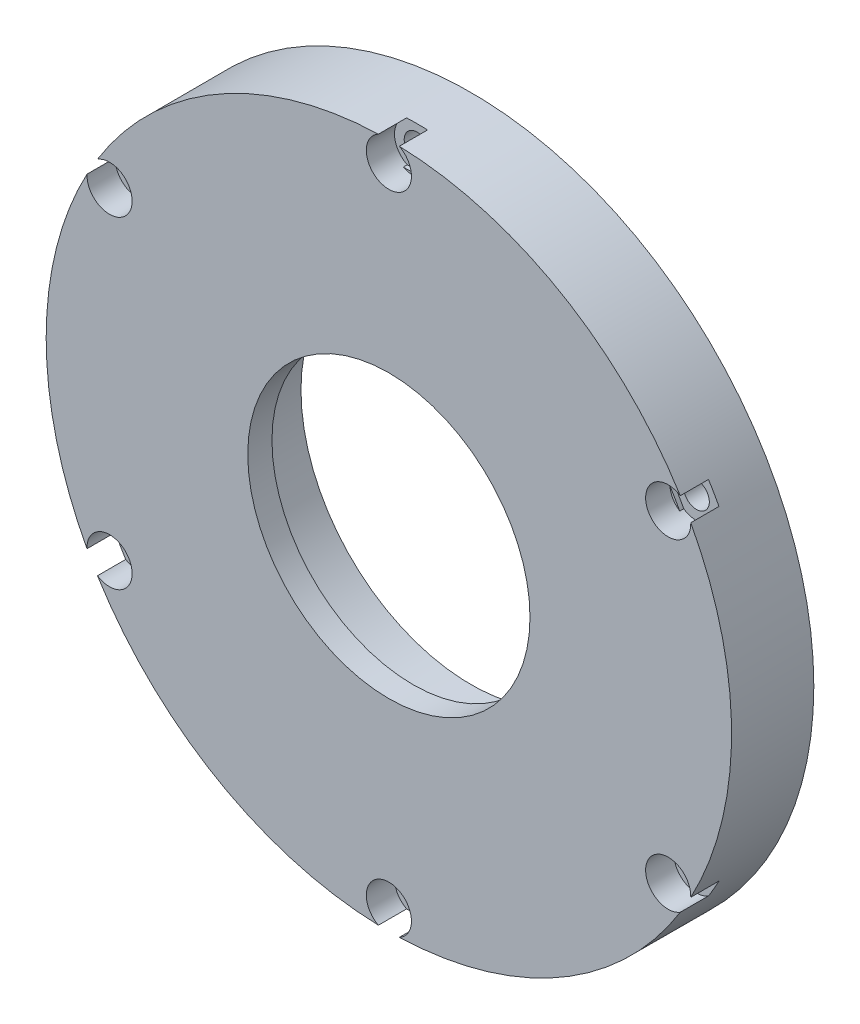
from build123d import *

# Parameters (mm, degrees)
SKETCH1_R           = 42.5
SKETCH1_R_2         = 1.6
SKETCH1_R_3         = 17.5
BOSS_EXTRUDE1_DEPTH = 3
BOSS_EXTRUDE3_START = 7.2
SKETCH2_R           = 42.5
SKETCH2_R_2         = 37.5
SKETCH2_R_3         = 1.6
SKETCH2_R_4         = 24.1
SKETCH2_R_5         = 21.1
BOSS_EXTRUDE3_DEPTH = 7.2
SKETCH3_R           = 2.8
CUT_EXTRUDE1_DEPTH  = 3.5
SKETCH4_R           = 37.5
SKETCH4_R_2         = 24.1
BOSS_EXTRUDE4_DEPTH = 7.2
SKETCH23_R          = 37.5
SKETCH23_R_2        = 24.1
CUT_EXTRUDE3_DEPTH  = 3
FILLET1_R           = 1.5


with BuildPart() as part:
    # Sketch1 → Boss-Extrude1 (new body)
    with BuildSketch(Plane.XY):
        with Locations((-319.708249559, 27.578631729)):
            Circle(SKETCH1_R)
        with Locations((-285.067233407, 47.578631729)):
            Circle(SKETCH1_R_2, mode=Mode.SUBTRACT)
        with Locations((-285.067233407, 7.578631729)):
            Circle(SKETCH1_R_2, mode=Mode.SUBTRACT)
        with Locations((-319.708249559, -12.421368271)):
            Circle(SKETCH1_R_2, mode=Mode.SUBTRACT)
        with Locations((-354.34926571, 7.578631729)):
            Circle(SKETCH1_R_2, mode=Mode.SUBTRACT)
        with Locations((-354.34926571, 47.578631729)):
            Circle(SKETCH1_R_2, mode=Mode.SUBTRACT)
        with Locations((-319.708249559, 67.578631729)):
            Circle(SKETCH1_R_2, mode=Mode.SUBTRACT)
        with Locations((-319.708249559, 27.578631729)):
            Circle(SKETCH1_R_3, mode=Mode.SUBTRACT)
    extrude(amount=BOSS_EXTRUDE1_DEPTH)

    # Sketch2 → Boss-Extrude3 (add)
    # profile 1 of 2: a face of its own
    with BuildSketch(Plane(origin=(0, 0, 0), x_dir=(-1, 0, 0), z_dir=(0, 0, -1)).offset(BOSS_EXTRUDE3_START)):
        with Locations((319.708249559, 27.578631729)):
            Circle(SKETCH2_R)
        with Locations((319.708249559, 27.578631729)):
            Circle(SKETCH2_R_2, mode=Mode.SUBTRACT)
        with Locations((285.067233407, 47.578631729)):
            Circle(SKETCH2_R_3, mode=Mode.SUBTRACT)
        with Locations((285.067233407, 7.578631729)):
            Circle(SKETCH2_R_3, mode=Mode.SUBTRACT)
        with Locations((354.34926571, 7.578631729)):
            Circle(SKETCH2_R_3, mode=Mode.SUBTRACT)
        with Locations((319.708249559, 67.578631729)):
            Circle(SKETCH2_R_3, mode=Mode.SUBTRACT)
        with Locations((354.34926571, 47.578631729)):
            Circle(SKETCH2_R_3, mode=Mode.SUBTRACT)
        with Locations((319.708249559, -12.421368271)):
            Circle(SKETCH2_R_3, mode=Mode.SUBTRACT)
    # profile 2 of 2: a face of its own
    with BuildSketch(Plane(origin=(0, 0, 0), x_dir=(-1, 0, 0), z_dir=(0, 0, -1)).offset(BOSS_EXTRUDE3_START)):
        with Locations(Location((319.708249559, 27.578631729, 0), (0, 0, 180))):
            Circle(SKETCH2_R_4)
        with Locations((319.708249559, 27.578631729)):
            Circle(SKETCH2_R_5, mode=Mode.SUBTRACT)
    extrude(amount=-BOSS_EXTRUDE3_DEPTH)

    # Sketch3 → Cut-Extrude1 (cut)
    with BuildSketch(Plane.XY.offset(3)):
        with Locations((-285.067233407, 47.578631729)):
            Circle(SKETCH3_R)
        with Locations((-285.067233407, 7.578631729)):
            Circle(SKETCH3_R)
        with Locations((-319.708249559, -12.421368271)):
            Circle(SKETCH3_R)
        with Locations((-354.34926571, 7.578631729)):
            Circle(SKETCH3_R)
        with Locations((-354.34926571, 47.578631729)):
            Circle(SKETCH3_R)
        with Locations((-319.708249559, 67.578631729)):
            Circle(SKETCH3_R)
    extrude(amount=-CUT_EXTRUDE1_DEPTH, mode=Mode.SUBTRACT)

    # Sketch4 → Boss-Extrude4 (add)
    with BuildSketch(Plane(origin=(0, 0, -7.2), x_dir=(-1, 0, 0), z_dir=(0, 0, -1))):
        with Locations((319.708249559, 27.578631729)):
            Circle(SKETCH4_R)
        with Locations((319.708249559, 27.578631729)):
            Circle(SKETCH4_R_2, mode=Mode.SUBTRACT)
    extrude(amount=-BOSS_EXTRUDE4_DEPTH)

    # Sketch23 → Cut-Extrude3 (cut)
    with BuildSketch(Plane(origin=(0, 0, -7.2), x_dir=(-1, 0, 0), z_dir=(0, 0, -1))):
        with Locations((319.708249559, 27.578631729)):
            Circle(SKETCH23_R)
        with Locations((319.708249559, 27.578631729)):
            Circle(SKETCH23_R_2, mode=Mode.SUBTRACT)
    extrude(amount=-CUT_EXTRUDE3_DEPTH, mode=Mode.SUBTRACT)

    # Fillet1
    fillet1_edges = [part.edges().sort_by_distance(p)[0] for p in [
        (-282.208249559, 27.578631729, -4.2),
        (-295.608249559, 27.578631729, -4.2),
    ]]
    fillet(fillet1_edges, radius=FILLET1_R)


solid = part.part
